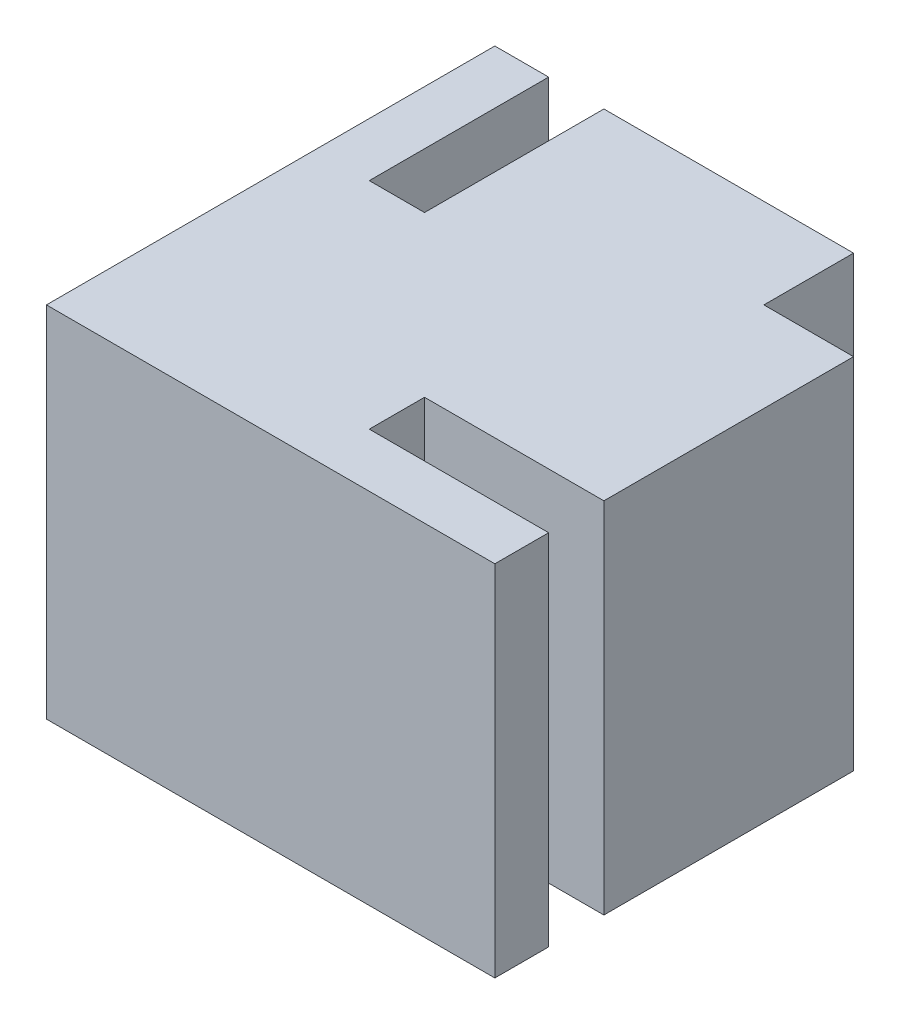
from build123d import *

# Parameters (mm, degrees)
SALIENTE_EXTRUIR1_DEPTH = 20
CROQUIS2_W              = 10
CROQUIS2_H              = 3.08
CROQUIS2_W_2            = 3.08
CROQUIS2_H_2            = 10
CORTAR_EXTRUIR2_DEPTH   = 20


with BuildPart() as part:
    # Croquis1 → Saliente-Extruir1 (new body)
    with BuildSketch(Plane(origin=(0, 0, 0), x_dir=(1, 0, 0), z_dir=(0, 1, 0))):
        Polygon((7.5, 12.5), (7.5, 7.5), (12.5, 7.5), (12.5, -12.5), (-12.5, -12.5), (-12.5, 12.5), align=None)
    extrude(amount=SALIENTE_EXTRUIR1_DEPTH)

    # Croquis2 → Cortar-Extruir2 (cut)
    with BuildSketch(Plane(origin=(0, 20, 0), x_dir=(1, 0, 0), z_dir=(0, 1, 0))):
        with Locations((7.5, -7.96)):
            Rectangle(CROQUIS2_W, CROQUIS2_H)
        with Locations((-7.96, 7.5)):
            Rectangle(CROQUIS2_W_2, CROQUIS2_H_2)
    extrude(amount=-CORTAR_EXTRUIR2_DEPTH, mode=Mode.SUBTRACT)


solid = part.part
